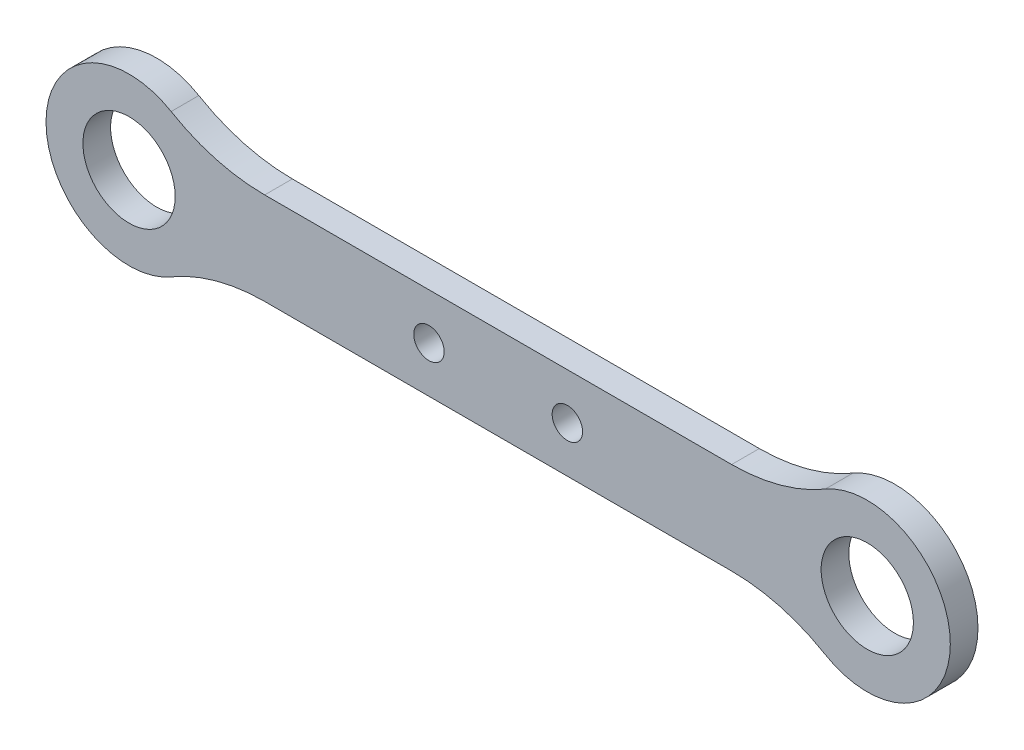
from build123d import *

# Parameters (mm, degrees)
ESBO_O1_R                = 5
ESBO_O1_R_2              = 1.65
RESSALTO_EXTRUS_O1_DEPTH = 3
FILETE1_R                = 20


with BuildPart() as part:
    # Esboço1 → Ressalto-extrusão1 (new body)
    with BuildSketch(Plane.XY):
        with BuildLine():
            Line((7.483314774, -5), (72.516685226, -5))
            ThreePointArc((72.516685226, -5), (89, 0), (72.516685226, 5))
            Line((72.516685226, 5), (7.483314774, 5))
            ThreePointArc((7.483314774, 5), (-9, 0), (7.483314774, -5))
        make_face()
        Circle(ESBO_O1_R, mode=Mode.SUBTRACT)
        with Locations((32.5, 0)):
            Circle(ESBO_O1_R_2, mode=Mode.SUBTRACT)
        with Locations((47.5, 0)):
            Circle(ESBO_O1_R_2, mode=Mode.SUBTRACT)
        with Locations((80, 0)):
            Circle(ESBO_O1_R, mode=Mode.SUBTRACT)
    extrude(amount=RESSALTO_EXTRUS_O1_DEPTH)

    # Filete1
    filete1_edges = [part.edges().sort_by_distance(p)[0] for p in [
        (72.516685226, -5, 1.5),
        (7.483314774, -5, 1.5),
        (7.483314774, 5, 1.5),
        (72.516685226, 5, 1.5),
    ]]
    fillet(filete1_edges, radius=FILETE1_R)


solid = part.part
